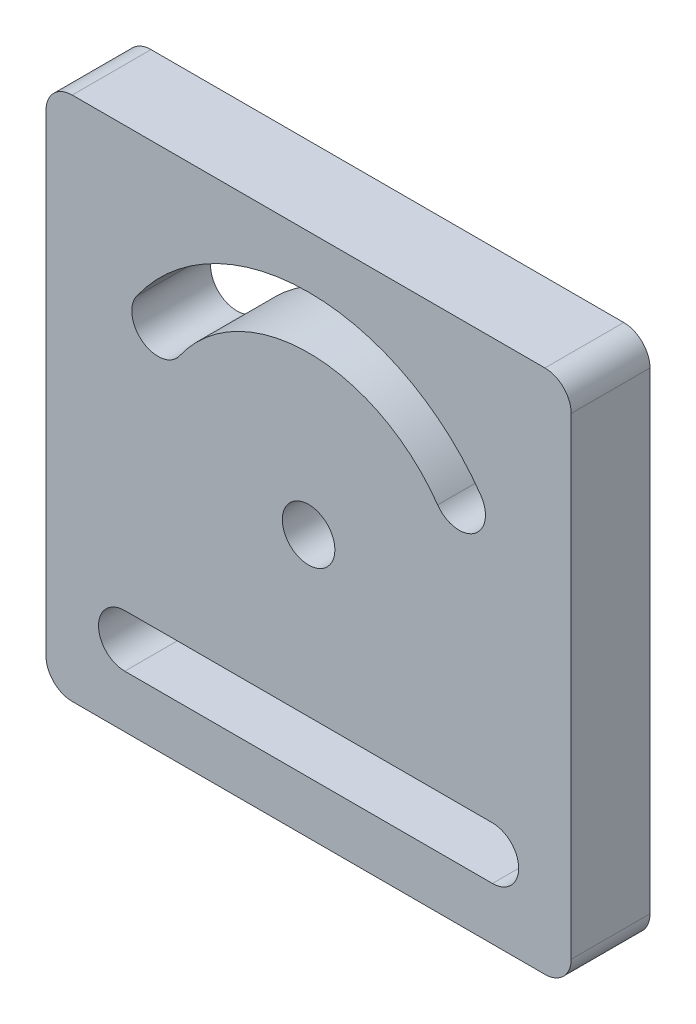
from build123d import *

# Parameters (mm, degrees)
SKETCH1_W           = 200
SKETCH1_H           = 200
SKETCH1_R           = 10
BOSS_EXTRUDE1_DEPTH = 30
FILLET1_R           = 10


with BuildPart() as part:
    # Sketch1 → Boss-Extrude1 (new body)
    with BuildSketch(Plane.XY):
        Rectangle(SKETCH1_W, SKETCH1_H)
        Circle(SKETCH1_R, mode=Mode.SUBTRACT)
        with BuildLine():
            Line((70, -80), (-70, -80))
            ThreePointArc((-70, -80), (-80, -70), (-70, -60))
            Line((-70, -60), (70, -60))
            ThreePointArc((70, -60), (80, -70), (70, -80))
        make_face(mode=Mode.SUBTRACT)
        with BuildLine():
            ThreePointArc((65.532163543, 45.886114908), (0, 80), (-65.532163543, 45.886114908))
            ThreePointArc((-65.532163543, 45.886114908), (-63.076407464, 31.958830102), (-49.149122657, 34.414586181))
            ThreePointArc((-49.149122657, 34.414586181), (0, 60), (49.149122657, 34.414586181))
            ThreePointArc((49.149122657, 34.414586181), (63.076407464, 31.958830102), (65.532163543, 45.886114908))
        make_face(mode=Mode.SUBTRACT)
    extrude(amount=BOSS_EXTRUDE1_DEPTH)

    # Fillet1
    fillet1_edges = [part.edges().sort_by_distance(p)[0] for p in [
        (-100, 100, 15),
        (100, 100, 15),
        (100, -100, 15),
        (-100, -100, 15),
    ]]
    fillet(fillet1_edges, radius=FILLET1_R)


solid = part.part
